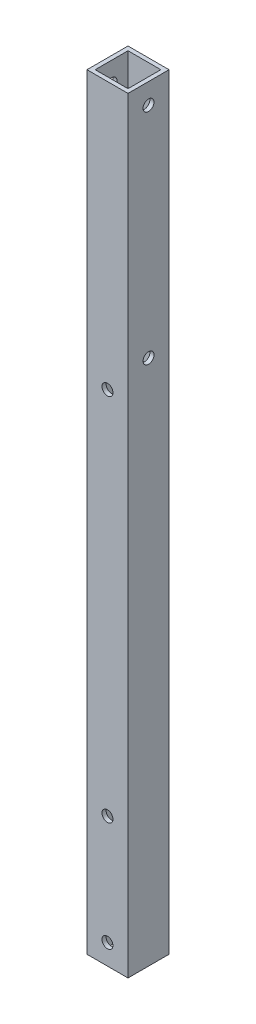
from build123d import *

# Parameters (mm, degrees)
SKETCH_1_W          = 15
SKETCH_1_H          = 15
SKETCH_1_W_2        = 12
SKETCH_1_H_2        = 12
EXTRUDE_1_DEPTH     = 280
SKETCH_2_R          = 2
CUT_EXTRUDE_1_DEPTH = 281.501782526
SKETCH_3_R          = 2
CUT_EXTRUDE_2_DEPTH = 281.501782526


with BuildPart() as part:
    # ｽｹｯﾁ1 → 押し出し-薄板1 (new body)
    with BuildSketch(Plane(origin=(0, 0, 0), x_dir=(1, 0, 0), z_dir=(0, 1, 0))):
        Rectangle(SKETCH_1_W, SKETCH_1_H)
        Rectangle(SKETCH_1_W_2, SKETCH_1_H_2, mode=Mode.SUBTRACT)
    extrude(amount=EXTRUDE_1_DEPTH)

    # ｽｹｯﾁ2 → ｶｯﾄ - 押し出し1 (cut, through all)
    with BuildSketch(Plane(origin=(7.5, 0, 0), x_dir=(0, 0, -1), z_dir=(1, 0, 0))):
        with Locations((0, 272.5)):
            Circle(SKETCH_2_R)
        with Locations((0, 192.5)):
            Circle(SKETCH_2_R)
    extrude(amount=-CUT_EXTRUDE_1_DEPTH, mode=Mode.SUBTRACT)

    # ｽｹｯﾁ3 → ｶｯﾄ - 押し出し2 (cut, through all)
    with BuildSketch(Plane.XY.offset(7.5)):
        with Locations((0, 7.5)):
            Circle(SKETCH_3_R)
        with Locations((0, 47.5)):
            Circle(SKETCH_3_R)
        with Locations((0, 182.5)):
            Circle(SKETCH_3_R)
    extrude(amount=-CUT_EXTRUDE_2_DEPTH, mode=Mode.SUBTRACT)


solid = part.part
